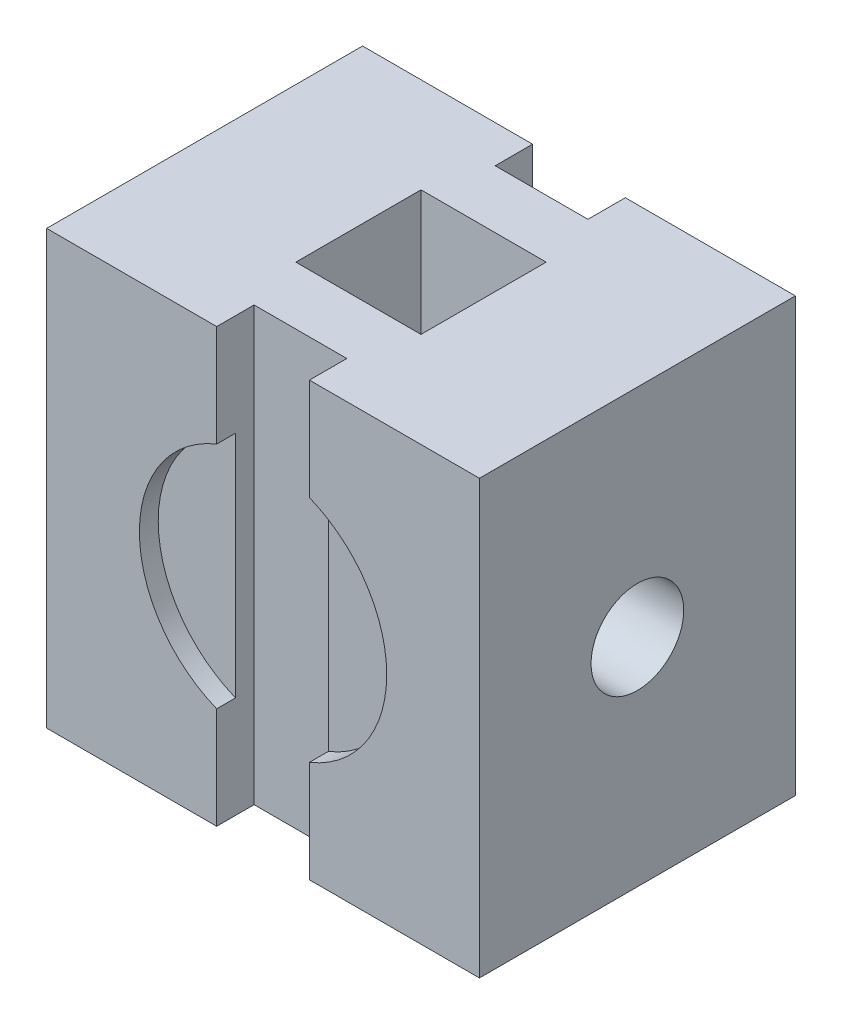
from build123d import *

# Parameters (mm, degrees)
SKETCH2_R           = 13.335
BOSS_EXTRUDE1_DEPTH = 2.032
SKETCH3_R           = 13.335
BOSS_EXTRUDE2_DEPTH = 2.032
BOSS_EXTRUDE3_START = -17.032
SKETCH5_W           = 46.67
SKETCH5_H           = 46.67
BOSS_EXTRUDE3_DEPTH = 34.064
SKETCH6_R           = 5
CUT_EXTRUDE1_DEPTH  = 55.888069277
SKETCH7_W           = 13.5
SKETCH7_H           = 13.5
CUT_EXTRUDE2_DEPTH  = 31.67
SKETCH9_W           = 10
SKETCH9_H           = 46.67
CUT_EXTRUDE3_DEPTH  = 4.032


with BuildPart() as part:
    # Sketch2 → Boss-Extrude1 (new body)
    with BuildSketch(Plane.XY.offset(15)):
        Circle(SKETCH2_R)
    extrude(amount=BOSS_EXTRUDE1_DEPTH)


with BuildPart() as body_2:
    # Sketch3 → Boss-Extrude2 (new body)
    with BuildSketch(Plane.XY.offset(-15)):
        Circle(SKETCH3_R)
    extrude(amount=-BOSS_EXTRUDE2_DEPTH)


with BuildPart() as body_3:
    # Sketch5 → Boss-Extrude3 (new body)
    with BuildSketch(Plane.XY.offset(BOSS_EXTRUDE3_START)):
        Rectangle(SKETCH5_W, SKETCH5_H)
    extrude(amount=BOSS_EXTRUDE3_DEPTH)

    # Sketch6 → Cut-Extrude1 (cut, through all)
    with BuildSketch(Plane.ZY.offset(23.335)):
        Circle(SKETCH6_R)
    extrude(amount=-CUT_EXTRUDE1_DEPTH, mode=Mode.SUBTRACT)

    # Sketch7 → Cut-Extrude2 (cut)
    with BuildSketch(Plane(origin=(0, 23.335, 0), x_dir=(1, 0, 0), z_dir=(0, 1, 0))):
        Rectangle(SKETCH7_W, SKETCH7_H)
    extrude(amount=-CUT_EXTRUDE2_DEPTH, mode=Mode.SUBTRACT)

    # Combine1: cut part, body 2
    add(part.part, mode=Mode.SUBTRACT)
    add(body_2.part, mode=Mode.SUBTRACT)

    # Sketch9 → Cut-Extrude3 (cut)
    with BuildSketch(Plane.XY.offset(17.032)):
        Rectangle(SKETCH9_W, SKETCH9_H)
    cut_extrude3 = extrude(amount=-CUT_EXTRUDE3_DEPTH, mode=Mode.SUBTRACT)

    # Mirror1: Cut-Extrude3 across plane
    add(cut_extrude3.mirror(Plane.XY), mode=Mode.SUBTRACT)


solid = body_3.part
